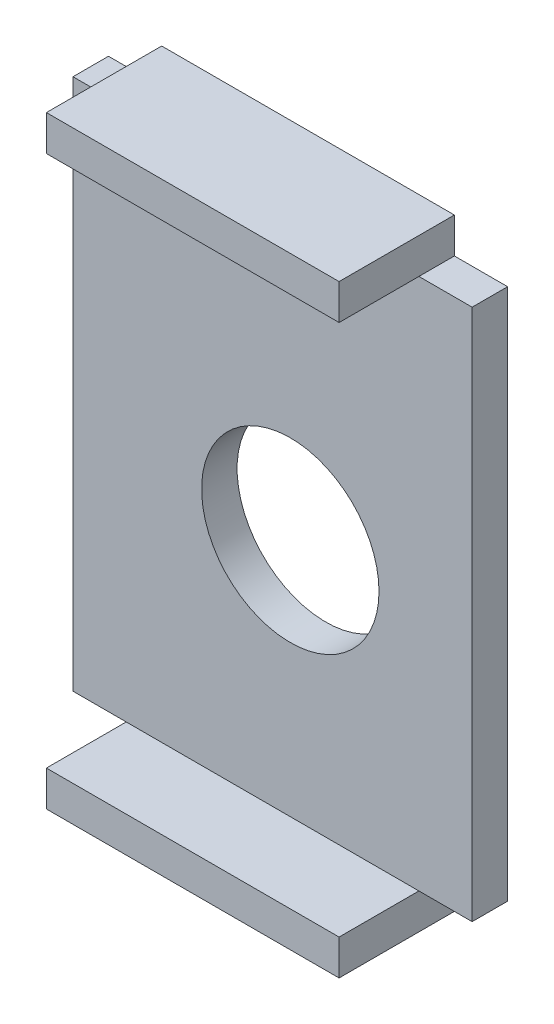
from build123d import *

# Parameters (mm, degrees)
SKETCH1_W           = 45
SKETCH1_H           = 60
SKETCH1_R           = 10
BOSS_EXTRUDE1_DEPTH = 2
SKETCH3_W           = 33
SKETCH3_H           = 4
BOSS_EXTRUDE3_DEPTH = 13


with BuildPart() as part:
    # Sketch1 → Boss-Extrude1 (new, symmetric)
    with BuildSketch(Plane.XY):
        Rectangle(SKETCH1_W, SKETCH1_H)
        with Locations((2, -3)):
            Circle(SKETCH1_R, mode=Mode.SUBTRACT)
    extrude(amount=BOSS_EXTRUDE1_DEPTH, both=True)

    # Sketch3 → Boss-Extrude3 (add)
    with BuildSketch(Plane(origin=(0, 0, -2), x_dir=(-1, 0, 0), z_dir=(0, 0, -1))):
        with Locations((0, 32)):
            Rectangle(SKETCH3_W, SKETCH3_H)
        with Locations((0, -32)):
            Rectangle(SKETCH3_W, SKETCH3_H)
    extrude(amount=-BOSS_EXTRUDE3_DEPTH)


solid = part.part
